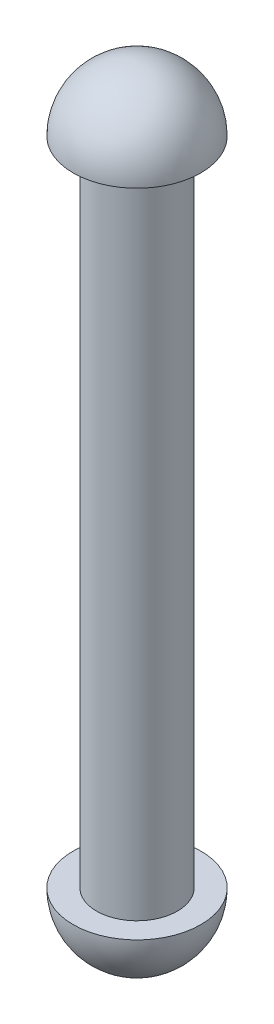
from build123d import *


with BuildPart() as part:
    # Sketch1 → Revolve4 (revolve)
    with BuildSketch(Plane.XY, mode=Mode.PRIVATE) as revolve4_sk:
        with BuildLine():
            ThreePointArc((0, -336), (-21.213203436, -327.213203436), (-30, -306))
            Line((-30, -306), (-19, -306))
            Line((-19, -306), (-19, 0))
            Line((-19, 0), (-30, 0))
            ThreePointArc((-30, 0), (-21.213203436, 21.213203436), (0, 30))
            Line((0, 30), (0, -336))
        make_face()
    revolve(revolve4_sk.sketch.rotate(Axis((0, 30, 0), (0, -1, 0)), 180), axis=Axis((0, 30, 0), (0, -1, 0)))


solid = part.part
